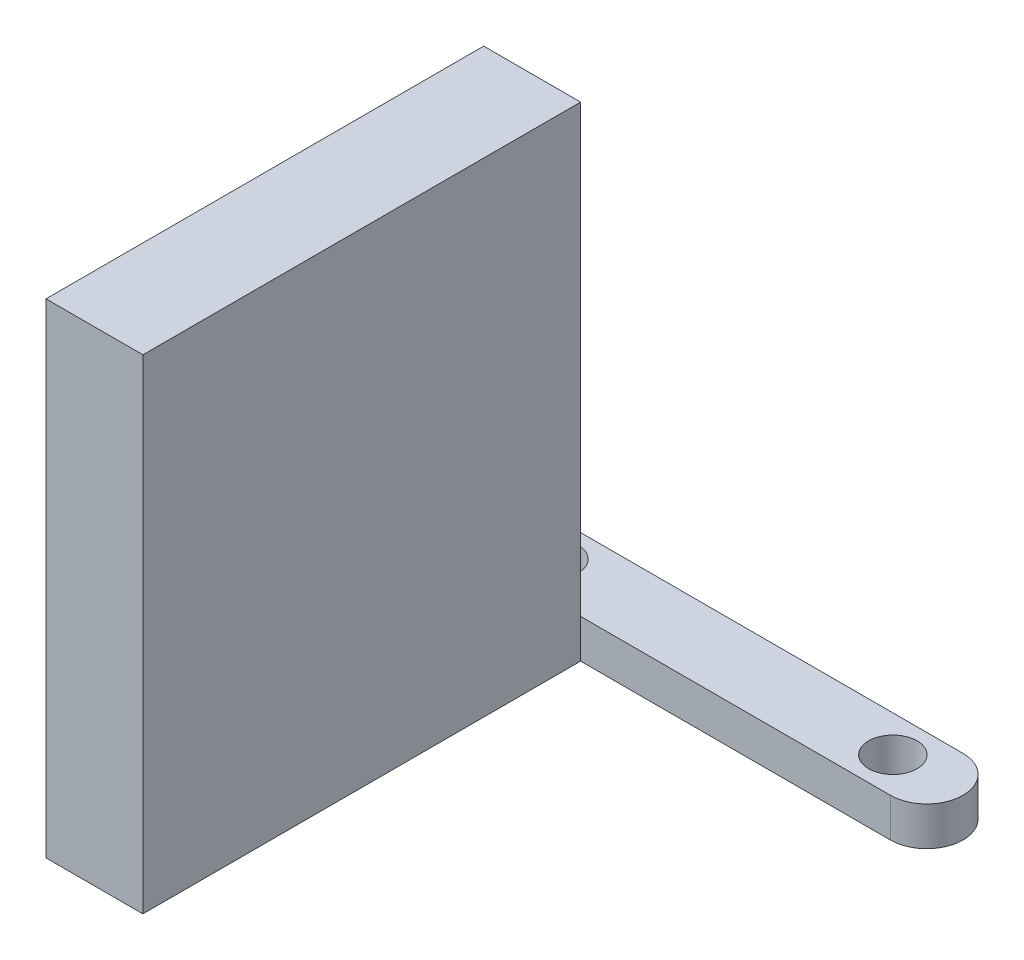
from build123d import *

# Parameters (mm, degrees)
SKETCH1_R           = 1.2499975
BOSS_EXTRUDE1_DEPTH = 1.999996
SKETCH2_W           = 5.0038
SKETCH2_H           = 22.6000056
BOSS_EXTRUDE2_DEPTH = 25.0000008


with BuildPart() as part:
    # Sketch1 → Boss-Extrude1 (new body)
    with BuildSketch(Plane(origin=(0, 0, 0), x_dir=(1, 0, 0), z_dir=(0, 1, 0))):
        with BuildLine():
            Line((-10.494133055, 1.188533953), (10.505875745, 1.188533953))
            ThreePointArc((10.505875745, 1.188533953), (12.380878345, -0.686468647), (10.505875745, -2.561471247))
            Line((10.505875745, -2.561471247), (-10.494133055, -2.561471247))
            ThreePointArc((-10.494133055, -2.561471247), (-12.369135655, -0.686468647), (-10.494133055, 1.188533953))
        make_face()
        with Locations(Location((-8.744123855, -0.686468647, 0), (0, 0, 270))):
            Circle(SKETCH1_R, mode=Mode.SUBTRACT)
        with Locations(Location((8.755866545, -0.686468647, 0), (0, 0, 90))):
            Circle(SKETCH1_R, mode=Mode.SUBTRACT)
    extrude(amount=BOSS_EXTRUDE1_DEPTH)

    # Sketch2 → Boss-Extrude2 (add)
    with BuildSketch(Plane.XZ):
        with Locations((-7.992233055, 13.861474047)):
            Rectangle(SKETCH2_W, SKETCH2_H)
    extrude(amount=-BOSS_EXTRUDE2_DEPTH)


solid = part.part
